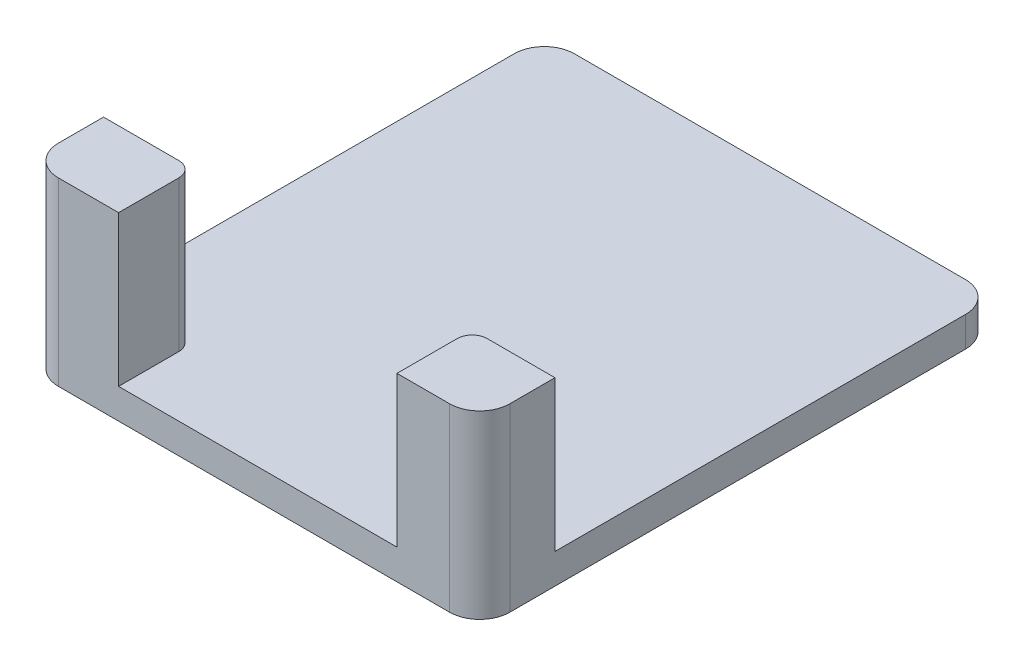
from build123d import *

# Parameters (mm, degrees)
SKETCH2_W           = 30
SKETCH2_H           = 34.29
BOSS_EXTRUDE1_DEPTH = 2
SKETCH3_W           = 5.5
SKETCH3_H           = 5
SKETCH3_W_2         = 6
BOSS_EXTRUDE2_DEPTH = 10
FILLET2_R           = 2
FILLET3_R           = 1


with BuildPart() as part:
    # Sketch2 → Boss-Extrude1 (new body)
    with BuildSketch(Plane(origin=(0, 0, 0), x_dir=(1, 0, 0), z_dir=(0, 1, 0))):
        with Locations((15, 17.145)):
            Rectangle(SKETCH2_W, SKETCH2_H)
    extrude(amount=BOSS_EXTRUDE1_DEPTH)

    # Sketch3 → Boss-Extrude2 (add)
    with BuildSketch(Plane(origin=(0, 2, 0), x_dir=(1, 0, 0), z_dir=(0, 1, 0))):
        with Locations((27.25, 2.5)):
            Rectangle(SKETCH3_W, SKETCH3_H)
        with Locations((3, 2.5)):
            Rectangle(SKETCH3_W_2, SKETCH3_H)
    extrude(amount=BOSS_EXTRUDE2_DEPTH)

    # Fillet2
    fillet2_edges = [part.edges().sort_by_distance(p)[0] for p in [
        (0, 1, -34.29),
        (30, 1, -34.29),
        (30, 6, 0),
        (0, 6, 0),
    ]]
    fillet(fillet2_edges, radius=FILLET2_R)

    # Fillet3
    fillet3_edges = [part.edges().sort_by_distance(p)[0] for p in [
        (24.5, 7, -5),
        (6, 7, -5),
    ]]
    fillet(fillet3_edges, radius=FILLET3_R)


solid = part.part
